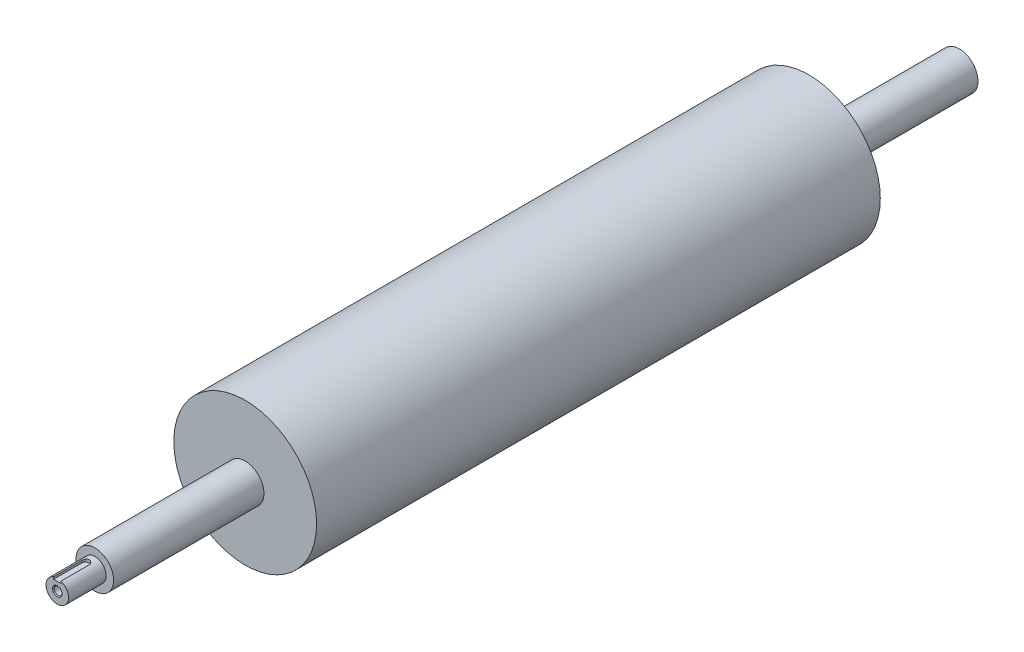
from build123d import *

# Parameters (mm, degrees)
SKETCH_1_R                   = 38
EXTRUDE_1_DEPTH              = 150
SKETCH_2_R                   = 10
EXTRUDE_2_DEPTH              = 80
SKETCH_3_R                   = 6
EXTRUDE_3_DEPTH              = 20
CUT_EXTRUDE_START            = 7.5
CUT_EXTRUDE_1_DEPTH          = 3
HOLE_WIZARD_M5_1_D           = 4.2
HOLE_WIZARD_M5_1_DEPTH       = 12.4
HOLE_WIZARD_M5_1_CSINK_D     = 5.05
HOLE_WIZARD_M5_1_CSINK_ANGLE = 90
HOLE_WIZARD_M5_1_TIP         = 1.2618073


with BuildPart() as part:
    # 草图1 → 凸台-拉伸1 (new, symmetric)
    with BuildSketch(Plane.XY):
        Circle(SKETCH_1_R)
    extrude(amount=EXTRUDE_1_DEPTH, both=True)

    # 草图2 → 凸台-拉伸2 (add)
    with BuildSketch(Plane.XY.offset(150)):
        Circle(SKETCH_2_R)
    extrude_2 = extrude(amount=EXTRUDE_2_DEPTH)

    # 镜向1: 凸台-拉伸2 across plane
    add(extrude_2.mirror(Plane.XY))

    # 草图3 → 凸台-拉伸3 (add)
    with BuildSketch(Plane.XY.offset(230)):
        Circle(SKETCH_3_R)
    extrude(amount=EXTRUDE_3_DEPTH)

    # 草图4 → 切除-拉伸1 (cut)
    with BuildSketch(Plane(origin=(0, 0, 0), x_dir=(1, 0, 0), z_dir=(0, 1, 0)).offset(CUT_EXTRUDE_START)):
        with BuildLine():
            Line((-2, -250), (-2, -235))
            ThreePointArc((-2, -235), (0, -233), (2, -235))
            Line((2, -235), (2, -250))
            ThreePointArc((2, -250), (0, -252), (-2, -250))
        make_face()
    extrude(amount=-CUT_EXTRUDE_1_DEPTH, mode=Mode.SUBTRACT)

    # M5 螺纹孔1
    with Locations(Plane.XY.offset(250)):
        with Locations((0, 0)):
            CounterSinkHole(HOLE_WIZARD_M5_1_D / 2, HOLE_WIZARD_M5_1_CSINK_D / 2, depth=HOLE_WIZARD_M5_1_DEPTH, counter_sink_angle=HOLE_WIZARD_M5_1_CSINK_ANGLE)
            with Locations((0, 0, -(HOLE_WIZARD_M5_1_DEPTH + HOLE_WIZARD_M5_1_TIP / 2))):  # 118° drill point
                Cone(0, HOLE_WIZARD_M5_1_D / 2, HOLE_WIZARD_M5_1_TIP, mode=Mode.SUBTRACT)


solid = part.part
